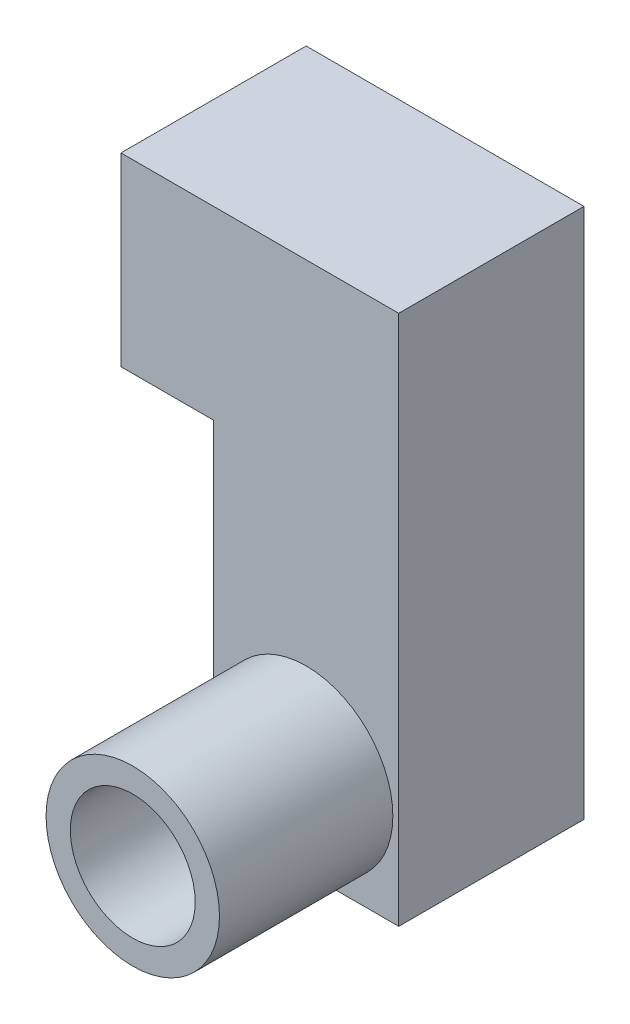
from build123d import *

# Parameters (mm, degrees)
BOSS_EXTRUDE1_DEPTH = 13.35
SKETCH3_R           = 9
CUT_EXTRUDE1_DEPTH  = 23
SKETCH4_R           = 11.5
CUT_EXTRUDE3_DEPTH  = 35.7
SKETCH7_R           = 9
CUT_EXTRUDE9_DEPTH  = 49.85
BOSS_EXTRUDE2_START = 25
SKETCH8_R           = 12.5
SKETCH8_R_2         = 9
BOSS_EXTRUDE2_DEPTH = 25


with BuildPart() as part:
    # Sketch2 → Boss-Extrude1 (new, symmetric)
    with BuildSketch(Plane.XY):
        Polygon((0, -13.35), (13.35, -13.35), (13.35, 63.2), (-26.7, 63.2), (-26.7, 36.5), (-13.35, 36.5), (-13.35, -13.35), align=None)
    extrude(amount=BOSS_EXTRUDE1_DEPTH, both=True)

    # Sketch3 → Cut-Extrude1 (cut)
    with BuildSketch(Plane.XY.offset(13.35)):
        Circle(SKETCH3_R)
    extrude(amount=-CUT_EXTRUDE1_DEPTH, mode=Mode.SUBTRACT)

    # Sketch4 → Cut-Extrude3 (cut)
    with BuildSketch(Plane.ZY.offset(26.7)):
        with Locations((0, 49.85)):
            Circle(SKETCH4_R)
    extrude(amount=-CUT_EXTRUDE3_DEPTH, mode=Mode.SUBTRACT)

    # Sketch7 → Cut-Extrude9 (cut)
    with BuildSketch(Plane(origin=(0, 0, 0), x_dir=(1, 0, 0), z_dir=(0, 1, 0))):
        Circle(SKETCH7_R)
    extrude(amount=CUT_EXTRUDE9_DEPTH, mode=Mode.SUBTRACT)

    # Sketch8 → Boss-Extrude2 (add)
    with BuildSketch(Plane.XY.offset(13.35).offset(BOSS_EXTRUDE2_START)):
        Circle(SKETCH8_R)
        Circle(SKETCH8_R_2, mode=Mode.SUBTRACT)
    extrude(amount=-BOSS_EXTRUDE2_DEPTH)


solid = part.part
